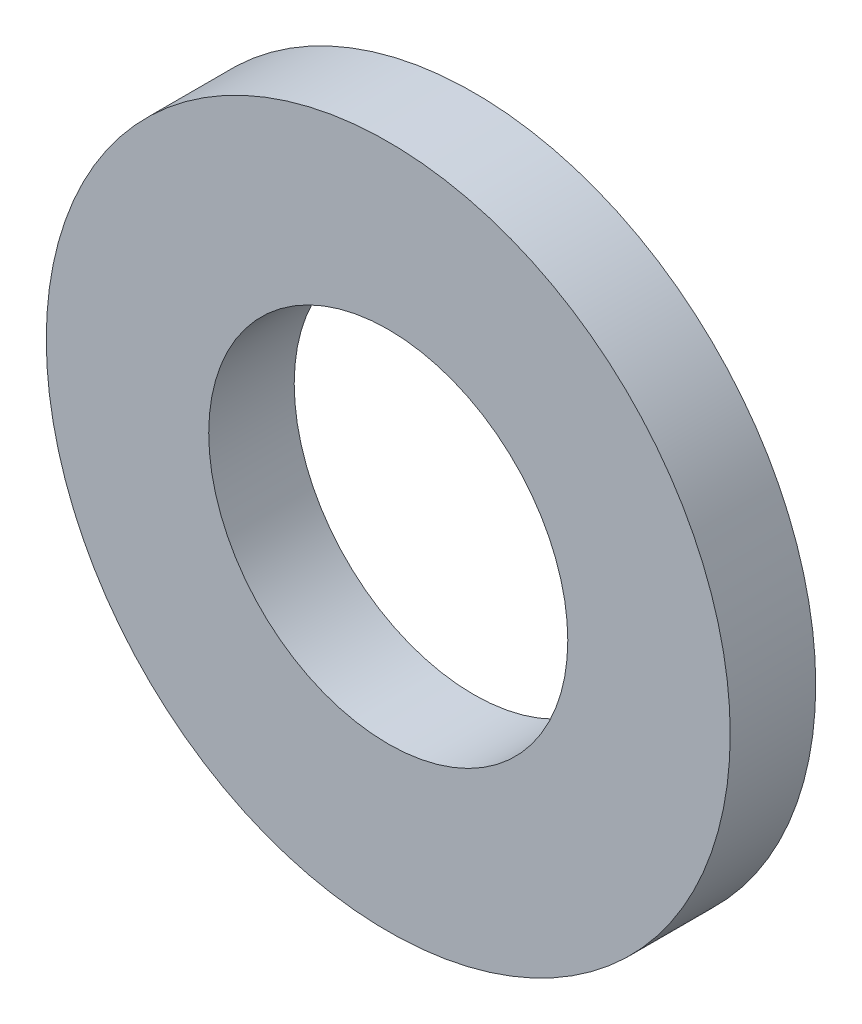
from build123d import *

# Parameters (mm, degrees)
ESQUISSE1_R        = 4
ESQUISSE1_R_2      = 2.1
BOSS_EXTRU_1_DEPTH = 1


with BuildPart() as part:
    # Esquisse1 → Boss.-Extru.1 (new body)
    with BuildSketch(Plane.XY):
        Circle(ESQUISSE1_R)
        Circle(ESQUISSE1_R_2, mode=Mode.SUBTRACT)
    extrude(amount=BOSS_EXTRU_1_DEPTH)


solid = part.part
